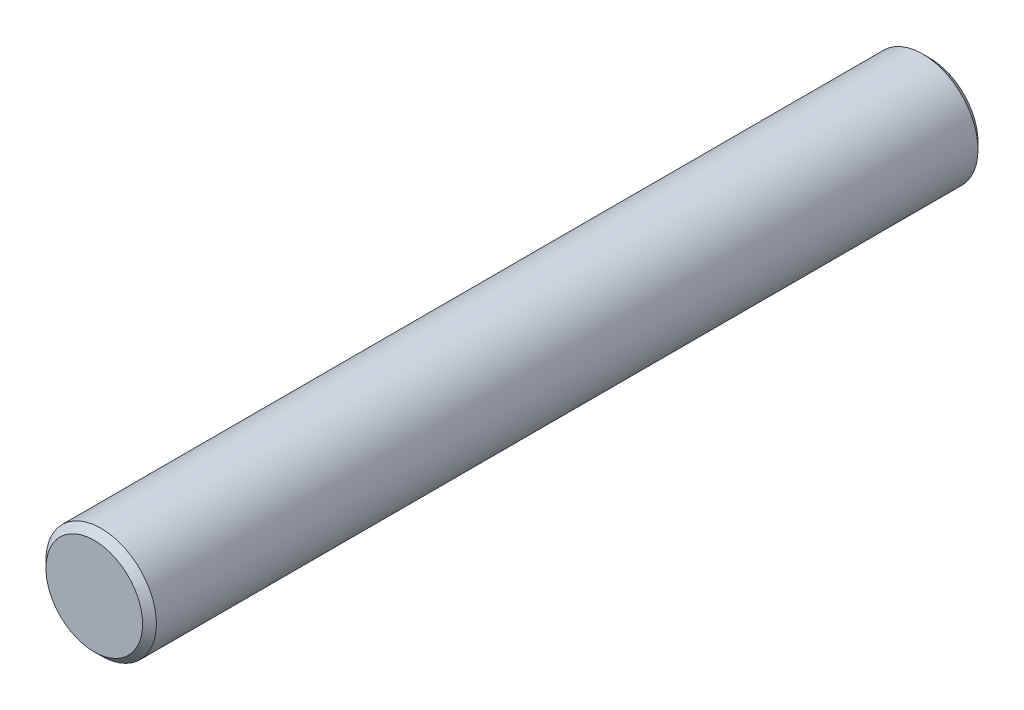
from build123d import *

# Parameters (mm, degrees)
SKETCH_1_R      = 8
EXTRUDE_1_DEPTH = 121
CHAMFER_1_SIZE  = 1


with BuildPart() as part:
    # 草图1 → 凸台-拉伸1 (new body)
    with BuildSketch(Plane.XY):
        Circle(SKETCH_1_R)
    extrude(amount=EXTRUDE_1_DEPTH)

    # 倒角1
    chamfer_1_edges = [part.edges().sort_by_distance(p)[0] for p in [
        (-8, 0, 0),
        (-8, 0, 121),
    ]]
    chamfer(chamfer_1_edges, length=CHAMFER_1_SIZE)


solid = part.part
